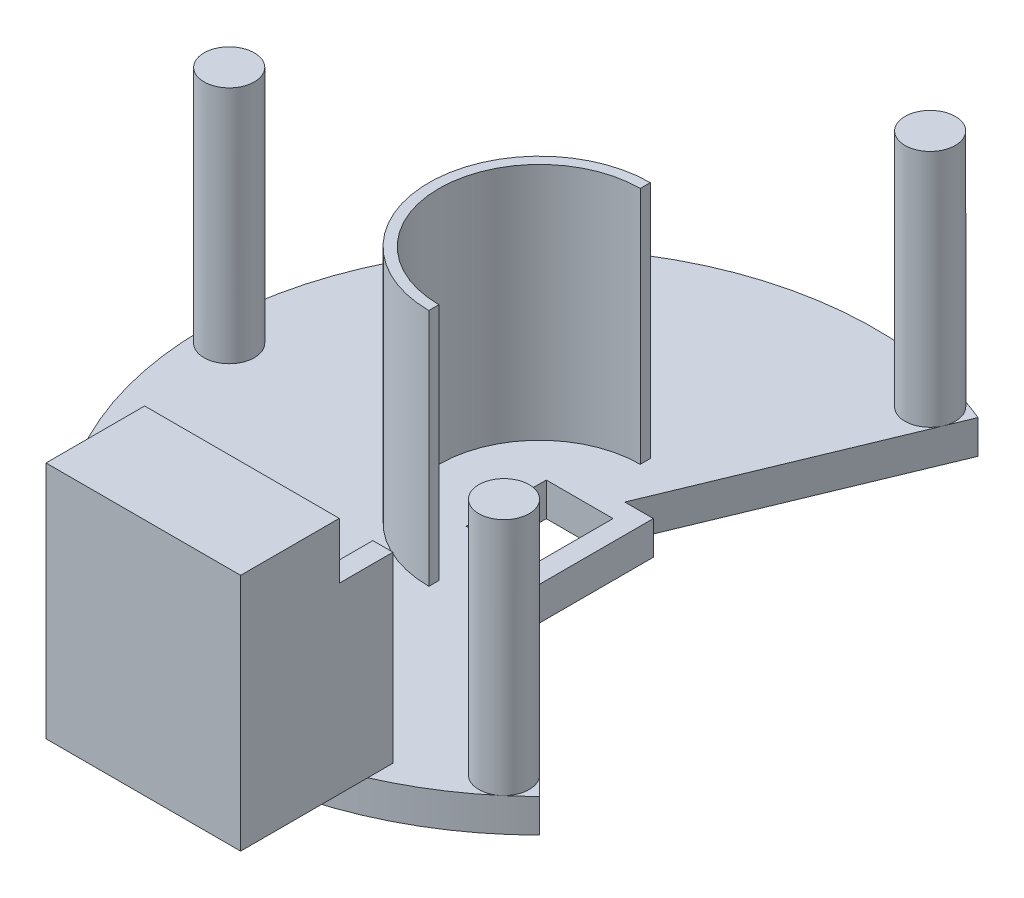
from build123d import *

# Parameters (mm, degrees)
SKETCH1_W           = 9.95
SKETCH1_H           = 11.95
BOSS_EXTRUDE2_DEPTH = 5
BOSS_EXTRUDE4_DEPTH = 27.23
SKETCH3_W           = 29
SKETCH3_H           = 14.7
BOSS_EXTRUDE5_DEPTH = 3
BOSS_EXTRUDE6_DEPTH = 35.6
SKETCH7_W           = 29
SKETCH7_H           = 14.7
BOSS_EXTRUDE7_DEPTH = 5.37
SKETCH8_R           = 3.75
BOSS_EXTRUDE8_DEPTH = 35.6


with BuildPart() as part:
    # Sketch1 → Boss-Extrude2 (new body)
    with BuildSketch(Plane(origin=(0, 0, 0), x_dir=(1, 0, 0), z_dir=(0, 1, 0))):
        with BuildLine():
            Line((35.355339059, -35.355339059), (7.975, -7.975))
            Line((7.975, -7.975), (7.975, 8.975))
            Line((7.975, 8.975), (3.717566722, 8.975))
            Line((3.717566722, 8.975), (19.134171618, 46.193976626))
            ThreePointArc((19.134171618, 46.193976626), (-48.299723588, 12.928136036), (-6.5, -49.575699692))
            Line((-6.5, -49.575699692), (-6.5, -42))
            ThreePointArc((-6.5, -42), (-1.406857491, -35.654075954), (5.891000616, -39.252981299))
            Line((5.891000616, -39.252981299), (10.393160878, -48.907895139))
            ThreePointArc((10.393160878, -48.907895139), (23.856849241, -43.941446771), (35.355339059, -35.355339059))
        make_face()
        Rectangle(SKETCH1_W, SKETCH1_H, mode=Mode.SUBTRACT)
    extrude(amount=BOSS_EXTRUDE2_DEPTH)

    # Sketch2 → Boss-Extrude4 (add)
    with BuildSketch(Plane(origin=(0, 5, 0), x_dir=(1, 0, 0), z_dir=(0, 1, 0))):
        with BuildLine():
            Line((17.15, -61.7), (-5.85, -61.7))
            Line((-5.85, -61.7), (-5.85, -50))
            Line((-5.85, -50), (-6.5, -49.575699692))
            ThreePointArc((-6.5, -49.575699692), (-7.67717135, -49.407095038), (-8.85, -49.21054257))
            Line((-8.85, -49.21054257), (-8.85, -64.7))
            Line((-8.85, -64.7), (20.15, -64.7))
            Line((20.15, -64.7), (20.15, -50))
            Line((20.15, -50), (20.15, -45.759998907))
            ThreePointArc((20.15, -45.759998907), (18.65975815, -46.387643029), (17.15, -46.966770168))
            Line((17.15, -46.966770168), (17.15, -50))
            Line((17.15, -50), (17.15, -61.7))
        make_face()
        with BuildLine():
            ThreePointArc((-8.85, -49.21054257), (-7.67717135, -49.407095038), (-6.5, -49.575699692))
            Line((-6.5, -49.575699692), (-6.5, -42))
            Line((-6.5, -42), (-8.85, -42))
            Line((-8.85, -42), (-8.85, -49.21054257))
        make_face()
        with BuildLine():
            Line((17.15, -42), (17.15, -46.966770168))
            ThreePointArc((17.15, -46.966770168), (18.65975815, -46.387643029), (20.15, -45.759998907))
            Line((20.15, -45.759998907), (20.15, -42))
            Line((20.15, -42), (17.15, -42))
        make_face()
    extrude(amount=BOSS_EXTRUDE4_DEPTH)

    # Sketch3 → Boss-Extrude5 (add)
    with BuildSketch(Plane(origin=(0, 32.23, 0), x_dir=(1, 0, 0), z_dir=(0, 1, 0))):
        with Locations((5.65, -57.35)):
            Rectangle(SKETCH3_W, SKETCH3_H)
    extrude(amount=BOSS_EXTRUDE5_DEPTH)

    # Sketch4 → Boss-Extrude6 (add)
    with BuildSketch(Plane(origin=(0, 5, 0), x_dir=(1, 0, 0), z_dir=(0, 1, 0))):
        with BuildLine():
            Line((0, 16.5), (0, 15))
            ThreePointArc((0, 15), (-15, 0), (0, -15))
            Line((0, -15), (0, -16.5))
            ThreePointArc((0, -16.5), (-16.5, 0), (0, 16.5))
        make_face()
    extrude(amount=BOSS_EXTRUDE6_DEPTH)

    # Sketch7 → Boss-Extrude7 (add)
    with BuildSketch(Plane(origin=(0, 35.23, 0), x_dir=(1, 0, 0), z_dir=(0, 1, 0))):
        with Locations((5.65, -57.35)):
            Rectangle(SKETCH7_W, SKETCH7_H)
    extrude(amount=BOSS_EXTRUDE7_DEPTH)

    # Sketch8 → Boss-Extrude8 (add)
    with BuildSketch(Plane(origin=(0, 5, 0), x_dir=(1, 0, 0), z_dir=(0, 1, 0))):
        with Locations(Location((14.176286342, 44.023804987, 0), (0, 0, 72.150709005))):
            Circle(SKETCH8_R)
        with Locations(Location((29.944361597, -35.247662455, 0), (0, 0, 45))):
            Circle(SKETCH8_R)
        with Locations(Location((-46.25, 0, 0), (0, 0, 179.999564815))):
            Circle(SKETCH8_R)
    extrude(amount=BOSS_EXTRUDE8_DEPTH)


solid = part.part
